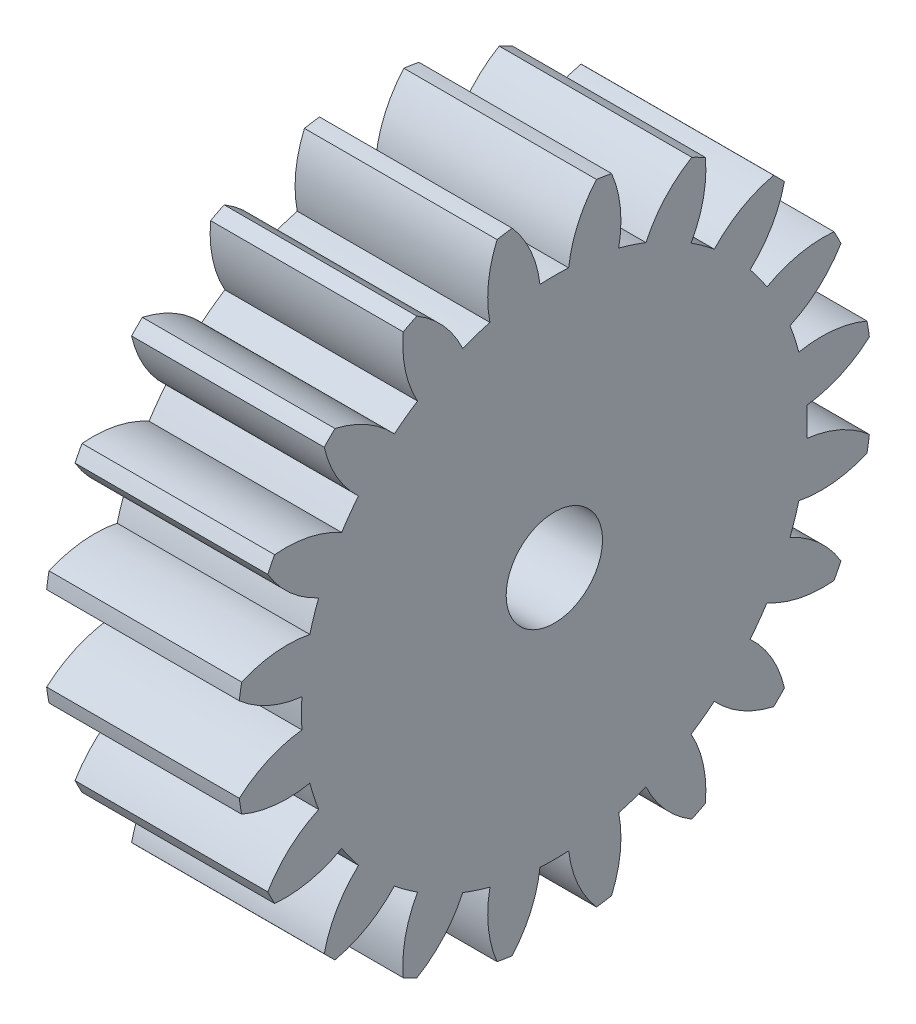
from build123d import *

# Parameters (mm, degrees)
BASPROSKE_W     = 10
BASPROSKE_H     = 16.5
TOOTHCUT_DEPTH  = 26.38700455
TEETHCUTS_COUNT = 20
TEETHCUTS_ANGLE = 342
BORSKE_R        = 2.5
BORE_DEPTH      = 50.0000508


with BuildPart() as part:
    # BasProSke → Base-Revolve (revolve)
    with BuildSketch(Plane(origin=(0, 0, 0), x_dir=(1, 0, 0), z_dir=(0, 1, 0)), mode=Mode.PRIVATE) as base_revolve_sk:
        with Locations((5, 8.25)):
            Rectangle(BASPROSKE_W, BASPROSKE_H)
    revolve(base_revolve_sk.sketch.rotate(Axis((-10, 0, 0), (1, 0, 0)), 180), axis=Axis((-10, 0, 0), (1, 0, 0)))

    # TooCutSke → ToothCut (cut, through all)
    with BuildSketch(Plane(origin=(0, 0, 0), x_dir=(0, 0, -1), z_dir=(1, 0, 0))):
        with BuildLine():
            ThreePointArc((0.74381438, 13.102904875), (0, 13.124), (-0.74381438, 13.102904875))
            ThreePointArc((-0.74381438, 13.102904875), (-1.226473103, 14.852072512), (-2.209965745, 16.376962373))
            ThreePointArc((-2.209965745, 16.376962373), (0, 16.5254), (2.209965745, 16.376962373))
            ThreePointArc((2.209965745, 16.376962373), (1.226473103, 14.852072512), (0.74381438, 13.102904875))
        make_face()
    toothcut = extrude(amount=TOOTHCUT_DEPTH, mode=Mode.SUBTRACT)

    # TeethCuts: ToothCut ×20 about axis
    teethcuts_axis = Axis((-10, 0, 0), (1, 0, 0))
    for i in range(1, TEETHCUTS_COUNT):
        add(toothcut.rotate(teethcuts_axis, i * TEETHCUTS_ANGLE / (TEETHCUTS_COUNT - 1)), mode=Mode.SUBTRACT)

    # BorSke → Bore (cut, symmetric)
    with BuildSketch(Plane(origin=(0, 0, 0), x_dir=(0, 0, -1), z_dir=(1, 0, 0))):
        with Locations(Location((0, 0, 0), (0, 0, 180))):
            Circle(BORSKE_R)
    extrude(amount=BORE_DEPTH, both=True, mode=Mode.SUBTRACT)


solid = part.part
